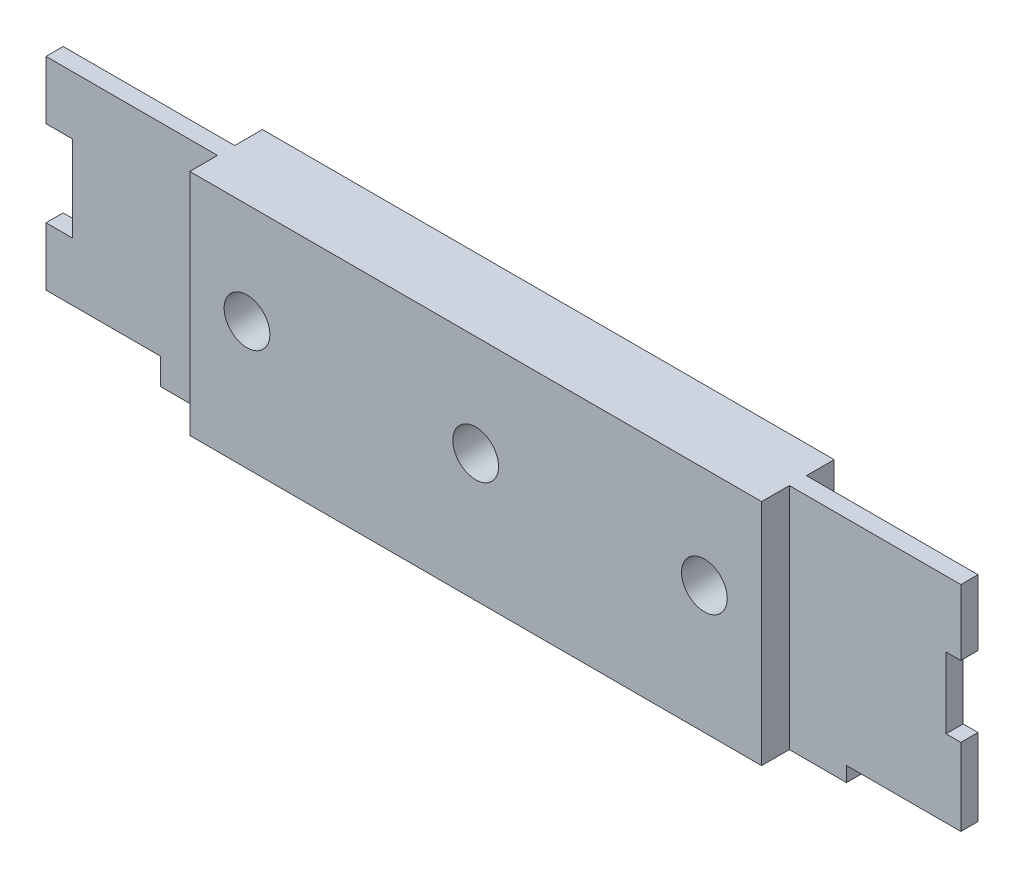
from build123d import *

# Parameters (mm, degrees)
CROQUIS1_R              = 2
SALIENTE_EXTRUIR1_DEPTH = 0.75
CROQUIS2_W              = 50
CROQUIS2_H              = 20
CROQUIS2_R              = 2
SALIENTE_EXTRUIR2_DEPTH = 3.175


with BuildPart() as part:
    # Croquis1 → Saliente-Extruir1 (new, symmetric)
    with BuildSketch(Plane.XY):
        Polygon((-40, 8.85), (40, 8.85), (40, 3.1), (38.7, 3.1), (38.7, -3.1), (40, -3.1), (40, -9.85), (30, -9.85), (30, -11.15), (-30, -11.15), (-30, -8.85), (-40, -8.85), (-40, -3.75), (-37.7, -3.75), (-37.7, 3.75), (-40, 3.75), align=None)
        with Locations((20, 0)):
            Circle(CROQUIS1_R, mode=Mode.SUBTRACT)
        Circle(CROQUIS1_R, mode=Mode.SUBTRACT)
        with Locations((-20, 0)):
            Circle(CROQUIS1_R, mode=Mode.SUBTRACT)
    extrude(amount=SALIENTE_EXTRUIR1_DEPTH, both=True)

    # Croquis2 → Saliente-Extruir2 (add, symmetric)
    with BuildSketch(Plane.XY):
        with Locations((0, -1.15)):
            Rectangle(CROQUIS2_W, CROQUIS2_H)
        with Locations((-20, 0)):
            Circle(CROQUIS2_R, mode=Mode.SUBTRACT)
        Circle(CROQUIS2_R, mode=Mode.SUBTRACT)
        with Locations((20, 0)):
            Circle(CROQUIS2_R, mode=Mode.SUBTRACT)
    extrude(amount=SALIENTE_EXTRUIR2_DEPTH, both=True)


solid = part.part
